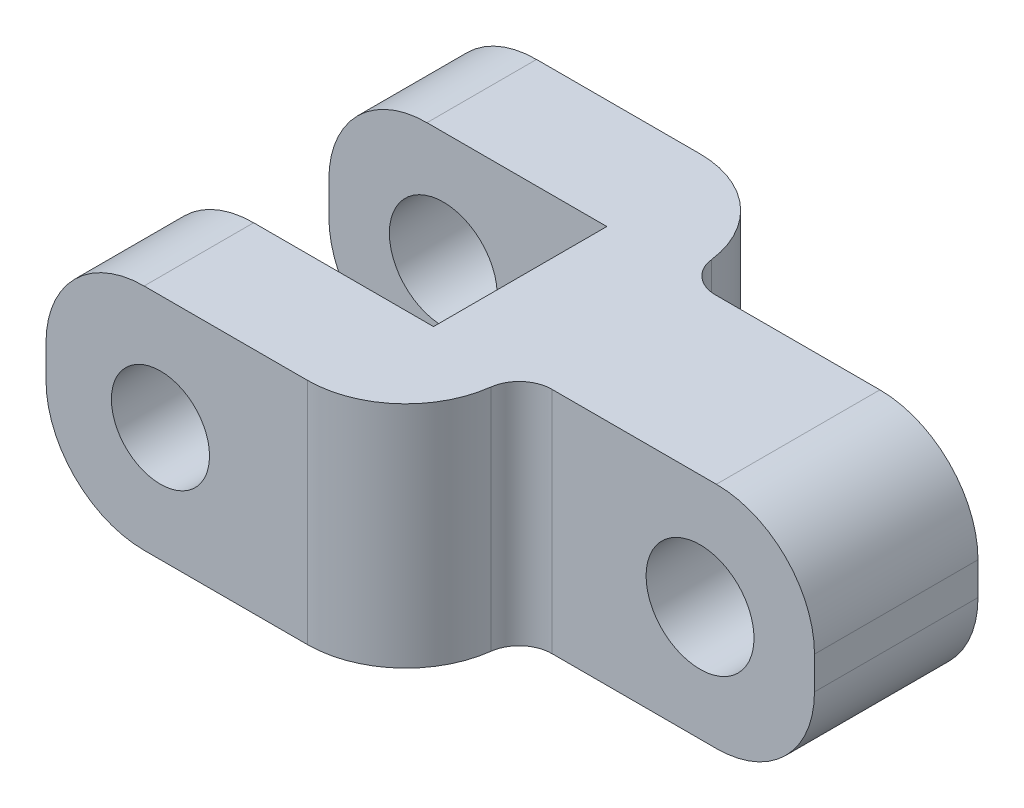
from build123d import *

# Parameters (mm, degrees)
SKETCH_1_W          = 20
SKETCH_1_H          = 7
SKETCH_1_R          = 1.65
EXTRUDE_1_DEPTH     = 12
SKETCH_2_W          = 8.5
SKETCH_2_H          = 5.3
CUT_EXTRUDE_1_DEPTH = 12
SKETCH_3_W          = 9
SKETCH_3_H          = 3.5
CUT_EXTRUDE_2_DEPTH = 12
FILLET_1_R          = 3
FILLET_2_R          = 3
FILLET_3_R          = 1
SKETCH_5_R          = 1.65
SKETCH_5_R_2        = 1.5
EXTRUDE_2_DEPTH     = 3.35


with BuildPart() as part:
    # 草图1 → 凸台-拉伸1 (new body)
    with BuildSketch(Plane.XY):
        Rectangle(SKETCH_1_W, SKETCH_1_H)
        with Locations((-6.5, 0)):
            Circle(SKETCH_1_R, mode=Mode.SUBTRACT)
        with Locations(Location((6.5, 0, 0), (0, 0, 180))):
            Circle(SKETCH_1_R, mode=Mode.SUBTRACT)
    extrude(amount=EXTRUDE_1_DEPTH)

    # 草图2 → 切除-拉伸1 (cut)
    with BuildSketch(Plane(origin=(0, 3.5, 0), x_dir=(1, 0, 0), z_dir=(0, 1, 0))):
        with Locations((-5.75, -6)):
            Rectangle(SKETCH_2_W, SKETCH_2_H)
    extrude(amount=-CUT_EXTRUDE_1_DEPTH, mode=Mode.SUBTRACT)

    # 草图3 → 切除-拉伸2 (cut)
    with BuildSketch(Plane(origin=(0, 3.5, 0), x_dir=(1, 0, 0), z_dir=(0, 1, 0))):
        with Locations((5.5, -1.75)):
            Rectangle(SKETCH_3_W, SKETCH_3_H)
        with Locations((5.5, -10.25)):
            Rectangle(SKETCH_3_W, SKETCH_3_H)
    extrude(amount=-CUT_EXTRUDE_2_DEPTH, mode=Mode.SUBTRACT)

    # 圆角1
    fillet_1_edges = [part.edges().sort_by_distance(p)[0] for p in [
        (-10, -3.5, 1.675),
        (-10, 3.5, 1.675),
        (10, -3.5, 6),
        (10, 3.5, 6),
        (-10, -3.5, 10.325),
        (-10, 3.5, 10.325),
    ]]
    fillet(fillet_1_edges, radius=FILLET_1_R)

    # 圆角2
    fillet_2_edges = [part.edges().sort_by_distance(p)[0] for p in [
        (1, 0, 0),
        (1, 0, 12),
    ]]
    fillet(fillet_2_edges, radius=FILLET_2_R)

    # 圆角3
    fillet_3_edges = [part.edges().sort_by_distance(p)[0] for p in [
        (1, 0, 3.5),
        (1, 0, 8.5),
    ]]
    fillet(fillet_3_edges, radius=FILLET_3_R)

    # 草图5 → 凸台-拉伸2 (add)
    with BuildSketch(Plane(origin=(0, 0, 8.65), x_dir=(-1, 0, 0), z_dir=(0, 0, -1))):
        with Locations((6.5, 0)):
            Circle(SKETCH_5_R)
        with Locations((6.5, 0)):
            Circle(SKETCH_5_R_2, mode=Mode.SUBTRACT)
    extrude(amount=-EXTRUDE_2_DEPTH)


solid = part.part
